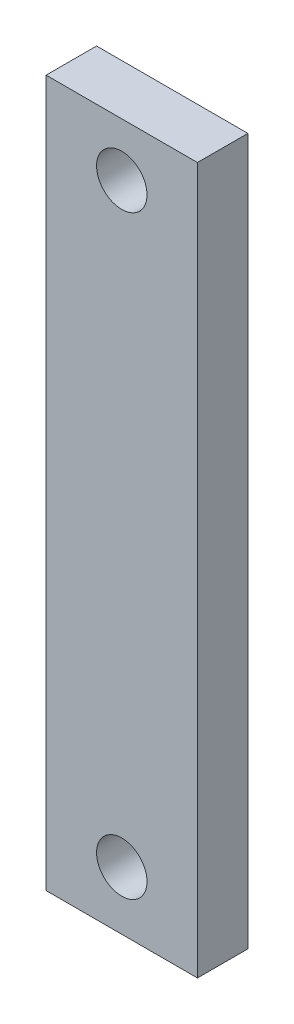
from build123d import *

# Parameters (mm, degrees)
SKETCH2_W           = 38.1
SKETCH2_H           = 177.8
BOSS_EXTRUDE1_DEPTH = 12.7
SKETCH7_R           = 6.35
CUT_EXTRUDE1_DEPTH  = 183.279291199
SKETCH4_R           = 6.35
CUT_EXTRUDE2_DEPTH  = 183.279291199


with BuildPart() as part:
    # Sketch2 → Boss-Extrude1 (new body)
    with BuildSketch(Plane.XY):
        with Locations((-19.05, 88.9)):
            Rectangle(SKETCH2_W, SKETCH2_H)
    extrude(amount=BOSS_EXTRUDE1_DEPTH)

    # Sketch7 → Cut-Extrude1 (cut, through all)
    with BuildSketch(Plane.XY.offset(12.7)):
        with Locations((-19.05, 164.387233427)):
            Circle(SKETCH7_R)
    extrude(amount=-CUT_EXTRUDE1_DEPTH, mode=Mode.SUBTRACT)

    # Sketch4 → Cut-Extrude2 (cut, through all)
    with BuildSketch(Plane.XY.offset(12.7)):
        with Locations((-19.05, 14.657453968)):
            Circle(SKETCH4_R)
    extrude(amount=-CUT_EXTRUDE2_DEPTH, mode=Mode.SUBTRACT)


solid = part.part
